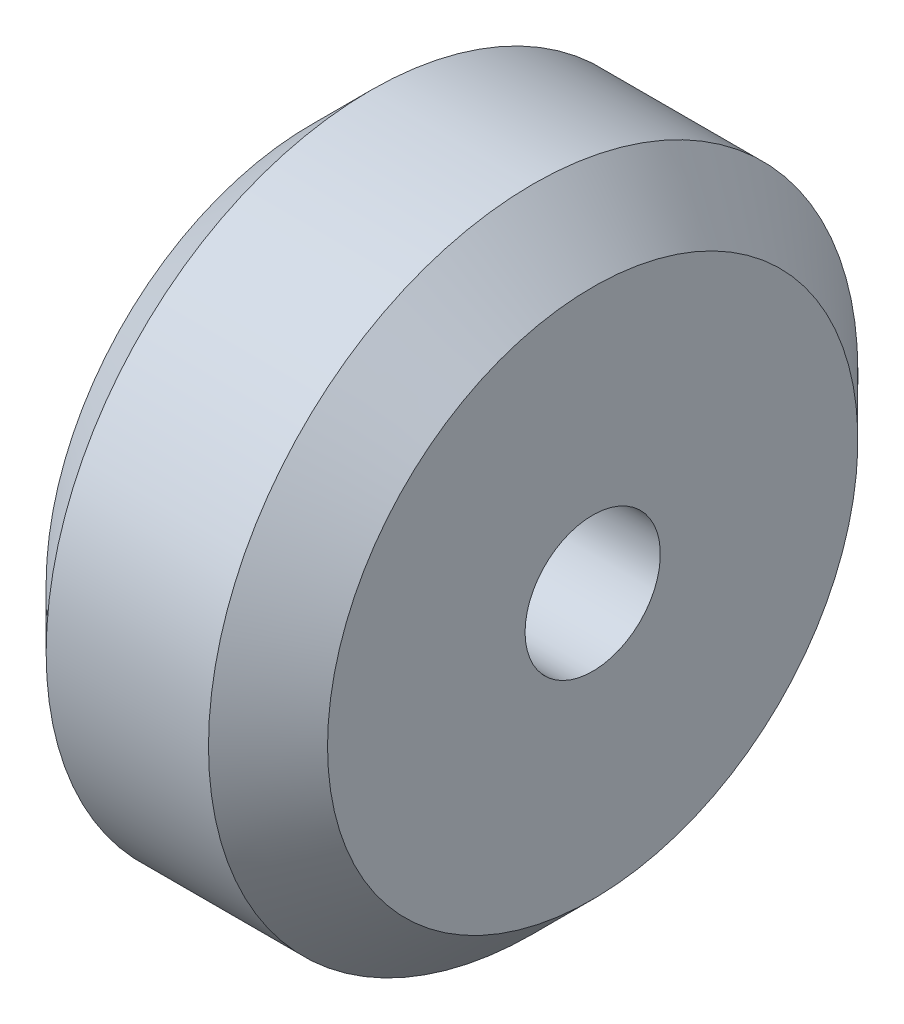
from build123d import *


with BuildPart() as part:
    # Croquis1 → Revolución2 (revolve)
    with BuildSketch(Plane.XY, mode=Mode.PRIVATE) as revoluci_n2_sk:
        Polygon((-5.2, 2.5), (5.2, 2.5), (5.2, 9.8), (3, 12), (-3, 12), (-5.2, 9.8), align=None)
    revolve(revoluci_n2_sk.sketch.rotate(Axis((-5.2, 0, 0), (1, 0, 0)), 90), axis=Axis((-5.2, 0, 0), (1, 0, 0)))


solid = part.part
